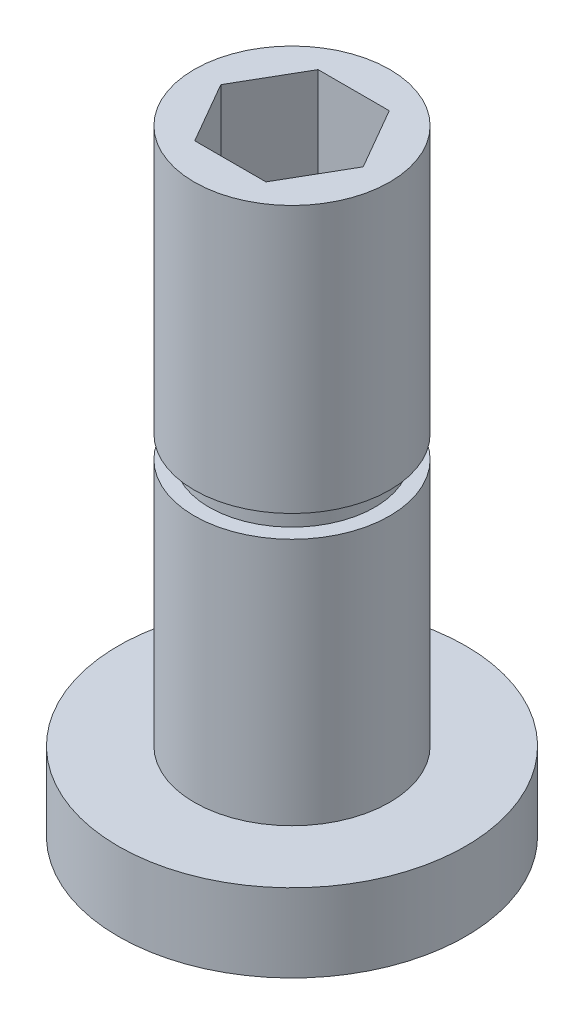
from build123d import *

# Parameters (mm, degrees)
SKETCH1_R                                     = 8.89
TRAINGULAR_BASE_SIMPLIFIED_TO_CIRCLE_HE_DEPTH = 4
SKETCH2_R                                     = 5
DRIVE_SHAFT_DEPTH                             = 27.5
SKETCH4_R                                     = 5
SKETCH4_R_2                                   = 4.238
RETAINING_RING_SLOT_DEPTH                     = 1.143
HEX_SLOT_DEPTH                                = 11.049


with BuildPart() as part:
    # Sketch1 → Traingular base (simplified to circle here) (new body)
    with BuildSketch(Plane(origin=(0, 0, 0), x_dir=(1, 0, 0), z_dir=(0, 1, 0))):
        with Locations(Location((0, 0, 0), (0, 0, 270))):
            Circle(SKETCH1_R)
    extrude(amount=TRAINGULAR_BASE_SIMPLIFIED_TO_CIRCLE_HE_DEPTH)

    # Sketch2 → Drive shaft (add)
    with BuildSketch(Plane(origin=(0, 4, 0), x_dir=(1, 0, 0), z_dir=(0, 1, 0))):
        with Locations(Location((0, 0, 0), (0, 0, 270))):
            Circle(SKETCH2_R)
    extrude(amount=DRIVE_SHAFT_DEPTH)

    # Sketch4 → Retaining ring slot (cut)
    with BuildSketch(Plane(origin=(0, 16.7, 0), x_dir=(1, 0, 0), z_dir=(0, 1, 0))):
        with Locations(Location((0, 0, 0), (0, 0, 270))):
            Circle(SKETCH4_R)
        with Locations(Location((0, 0, 0), (0, 0, 270))):
            Circle(SKETCH4_R_2, mode=Mode.SUBTRACT)
    extrude(amount=RETAINING_RING_SLOT_DEPTH, mode=Mode.SUBTRACT)

    # Sketch5 → Hex slot (cut)
    with BuildSketch(Plane(origin=(0, 31.5, 0), x_dir=(1, 0, 0), z_dir=(0, 1, 0))):
        Polygon((3.6449, 0), (1.82245, 3.156575994), (-1.82245, 3.156575994), (-3.6449, 0), (-1.82245, -3.156575994), (1.82245, -3.156575994), align=None)
    extrude(amount=-HEX_SLOT_DEPTH, mode=Mode.SUBTRACT)


solid = part.part
